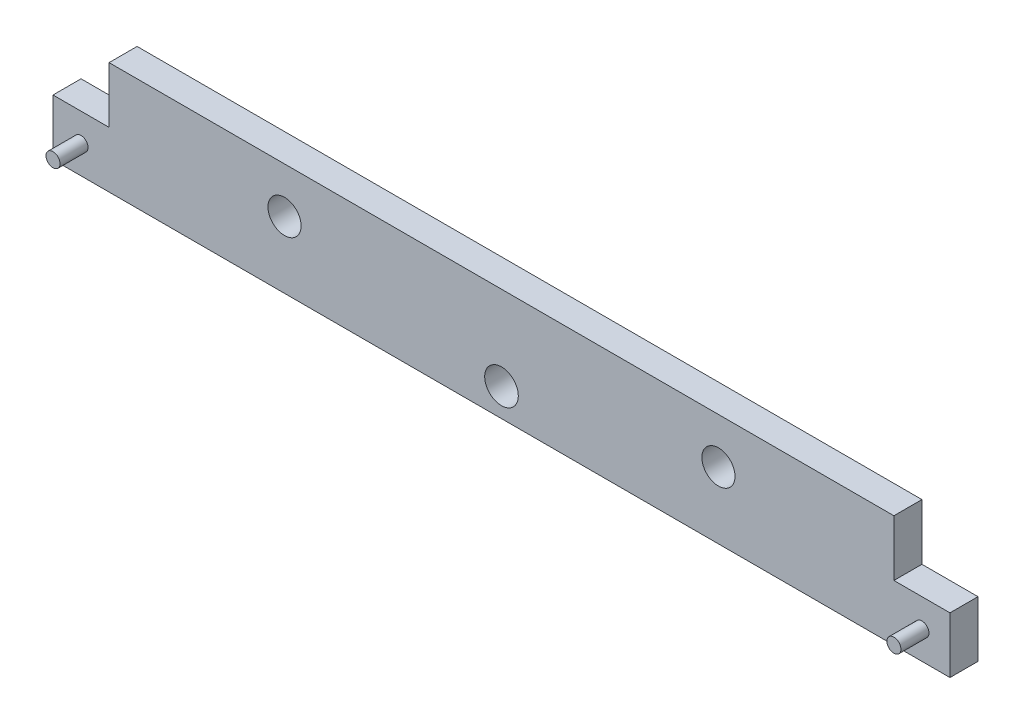
from build123d import *

# Parameters (mm, degrees)
SKETCH1_W           = 320
SKETCH1_H           = 20
BOSS_EXTRUDE1_DEPTH = 10
SKETCH2_R           = 2.5
BOSS_EXTRUDE2_DEPTH = 10
SKETCH4_R           = 6
CUT_EXTRUDE1_DEPTH  = 60
SKETCH5_W           = 280
SKETCH5_H           = 10
BOSS_EXTRUDE3_DEPTH = 20
SKETCH6_R           = 5.912914271
CUT_EXTRUDE2_DEPTH  = 20


with BuildPart() as part:
    # Sketch1 → Boss-Extrude1 (new body)
    with BuildSketch(Plane.XY):
        with Locations((-160, 10)):
            Rectangle(SKETCH1_W, SKETCH1_H)
    extrude(amount=BOSS_EXTRUDE1_DEPTH)

    # Sketch2 → Boss-Extrude2 (add)
    with BuildSketch(Plane.XY.offset(10)):
        with Locations((-10, 10)):
            Circle(SKETCH2_R)
    boss_extrude2 = extrude(amount=BOSS_EXTRUDE2_DEPTH)

    # Mirror1: Boss-Extrude2 across plane
    add(boss_extrude2.mirror(Plane(origin=(-160, 0, 0), x_dir=(0, 0, 1), z_dir=(1, 0, 0))))

    # Sketch4 → Cut-Extrude1 (cut)
    with BuildSketch(Plane.XY.offset(10)):
        with Locations((-160, 10)):
            Circle(SKETCH4_R)
    extrude(amount=-CUT_EXTRUDE1_DEPTH, mode=Mode.SUBTRACT)

    # Sketch5 → Boss-Extrude3 (add)
    with BuildSketch(Plane(origin=(0, 20, 0), x_dir=(1, 0, 0), z_dir=(0, 1, 0))):
        with Locations((-160, -5)):
            Rectangle(SKETCH5_W, SKETCH5_H)
    extrude(amount=BOSS_EXTRUDE3_DEPTH)

    # Sketch6 → Cut-Extrude2 (cut)
    with BuildSketch(Plane(origin=(0, 0, 0), x_dir=(-1, 0, 0), z_dir=(0, 0, -1))):
        with Locations((237.401391361, 23.777250692)):
            Circle(SKETCH6_R)
    cut_extrude2 = extrude(amount=-CUT_EXTRUDE2_DEPTH, mode=Mode.SUBTRACT)

    # Mirror2: Cut-Extrude2 across plane
    add(cut_extrude2.mirror(Plane(origin=(-160, 0, 0), x_dir=(0, 0, 1), z_dir=(1, 0, 0))), mode=Mode.SUBTRACT)


solid = part.part
